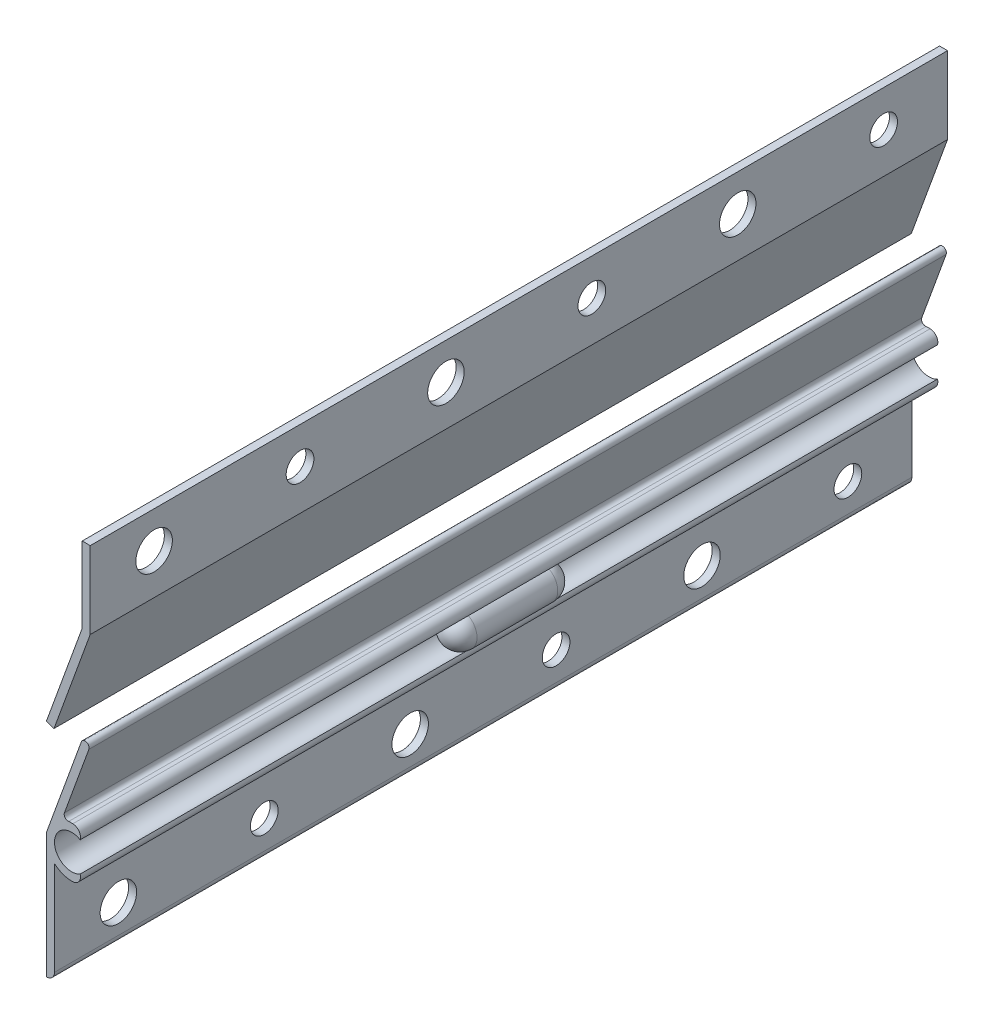
from build123d import *

# Parameters (mm, degrees)
BOSS_EXTRUDE1_DEPTH      = 74.6252
BOSS_EXTRUDE1_DEPTH_BACK = 74.6252
BOSS_EXTRUDE2_DEPTH      = 74.6252
BOSS_EXTRUDE2_DEPTH_BACK = 74.6252
SKETCH6_R                = 3.175
SKETCH6_R_2              = 2.413
CUT_EXTRUDE1_DEPTH       = 80.819753595
LPATTERN1_COUNT          = 3
LPATTERN1_PITCH          = 50.8
SKETCH7_R                = 3.175
SKETCH7_R_2              = 2.413
CUT_EXTRUDE2_DEPTH       = 80.819753595
LPATTERN2_COUNT          = 3
LPATTERN2_PITCH          = 50.8


with BuildPart() as part:
    # Sketch3 → Boss-Extrude1 (new, two sides: drawn at the far end of the back side and taken through both)
    with BuildSketch(Plane.XY.offset(-BOSS_EXTRUDE1_DEPTH_BACK)):
        Polygon((-3.81, -2.18919786), (-2.497249409, -2.667), (3.81, 14.662025329), (3.81, 28.067), (2.413, 28.067), (2.413, 14.908354121), align=None)
    extrude(amount=BOSS_EXTRUDE1_DEPTH + BOSS_EXTRUDE1_DEPTH_BACK)

    # Sketch6 → Cut-Extrude1 (cut, symmetric)
    with BuildSketch(Plane(origin=(0, 0, 0), x_dir=(0, 0, -1), z_dir=(1, 0, 0))):
        with Locations((-63.5, 21.717)):
            Circle(SKETCH6_R)
        with Locations((-38.1, 21.717)):
            Circle(SKETCH6_R_2)
    cut_extrude1 = extrude(amount=CUT_EXTRUDE1_DEPTH, both=True, mode=Mode.SUBTRACT)

    # LPattern1: Cut-Extrude1 ×3
    with Locations(*[(0, 0, -i * LPATTERN1_PITCH) for i in range(1, LPATTERN1_COUNT)]):
        add(cut_extrude1, mode=Mode.SUBTRACT)


with BuildPart() as body_2:
    # Sketch4 → Boss-Extrude2 (new, two sides: drawn at the far end of the back side and taken through both)
    with BuildSketch(Plane.XY.offset(-BOSS_EXTRUDE2_DEPTH_BACK)):
        with BuildLine():
            Line((3.57109893, 9.921095287), (-0.682123325, -1.76453682))
            ThreePointArc((-0.682123325, -1.76453682), (-0.573440364, -2.436953008), (0.056053641, -2.697131436))
            ThreePointArc((0.056053641, -2.697131436), (0.422913624, -2.669433005), (0.790803883, -2.672628026))
            ThreePointArc((0.790803883, -2.672628026), (1.859845269, -3.260146124), (2.059796865, -4.463494103))
            ThreePointArc((2.059796865, -4.463494103), (-2.413, -7.045864577), (2.059796865, -9.62823505))
            ThreePointArc((2.059796865, -9.62823505), (1.859845269, -10.831583029), (0.790803883, -11.419101127))
            ThreePointArc((0.790803883, -11.419101127), (-0.929300136, -11.160467531), (-2.413, -10.252566718))
            Line((-2.413, -10.252566718), (-2.413, -26.67))
            ThreePointArc((-2.413, -26.67), (-2.822171827, -27.657828173), (-3.81, -28.067))
            Line((-3.81, -28.067), (-3.81, -6.273752607))
            Line((-3.81, -6.273752607), (2.258348339, 10.398897427))
            ThreePointArc((2.258348339, 10.398897427), (3.153624704, 10.816371653), (3.57109893, 9.921095287))
        make_face()
    extrude(amount=BOSS_EXTRUDE2_DEPTH + BOSS_EXTRUDE2_DEPTH_BACK)

    # Sketch7 → Cut-Extrude2 (cut, symmetric)
    with BuildSketch(Plane(origin=(0, 0, 0), x_dir=(0, 0, -1), z_dir=(1, 0, 0))):
        with Locations((-63.5, -21.717)):
            Circle(SKETCH7_R)
        with Locations((-38.1, -21.717)):
            Circle(SKETCH7_R_2)
    cut_extrude2 = extrude(amount=CUT_EXTRUDE2_DEPTH, both=True, mode=Mode.SUBTRACT)

    # LPattern2: Cut-Extrude2 ×3
    with Locations(*[(0, 0, -i * LPATTERN2_PITCH) for i in range(1, LPATTERN2_COUNT)]):
        add(cut_extrude2, mode=Mode.SUBTRACT)


with BuildPart() as body_3:
    # Sketch5 → Revolve1 (revolve)
    with BuildSketch(Plane(origin=(0.568864577, 0, 0), x_dir=(0, 0, -1), z_dir=(1, 0, 0))):
        with BuildLine():
            Line((-10.007717462, -7.045864577), (10.007717462, -7.045864577))
            ThreePointArc((10.007717462, -7.045864577), (9.134349548, -4.937367914), (7.025852886, -4.064))
            Line((7.025852886, -4.064), (2.341950962, -4.064))
            Line((2.341950962, -4.064), (-2.341950962, -4.064))
            Line((-2.341950962, -4.064), (-7.025852886, -4.064))
            ThreePointArc((-7.025852886, -4.064), (-9.134349548, -4.937367914), (-10.007717462, -7.045864577))
        make_face()
    revolve(axis=Axis((0.568864577, -7.045864577, -10.007717462), (0, 0, -1)))


with BuildPart() as part_1:
    # Body-Move/Copy2: moved
    add(part.part.moved(Location((0, 6.35, 0))))


with BuildPart() as body_3_1:
    # Body-Move/Copy3: moved
    add(body_3.part.moved(Location((0, -6.35, 0))))


with BuildPart() as body_2_1:
    # Body-Move/Copy3: moved
    add(body_2.part.moved(Location((0, -6.35, 0))))


solid = Compound([part_1.part, body_3_1.part, body_2_1.part])
